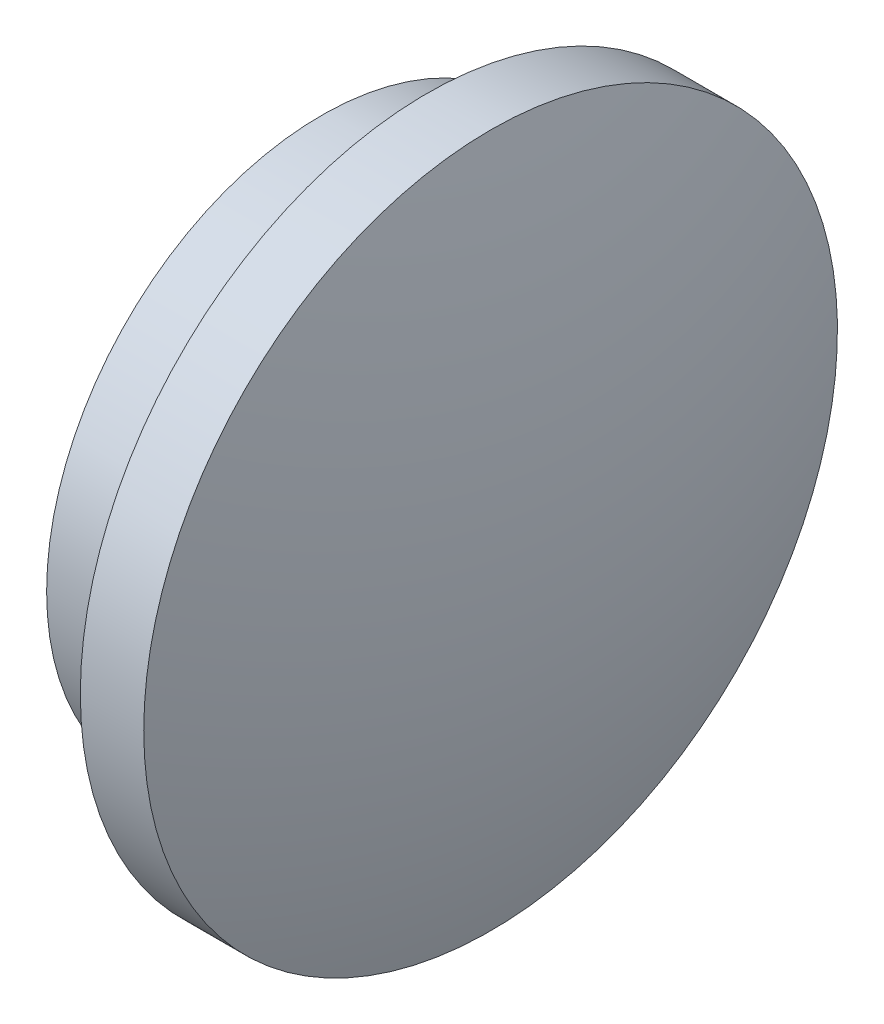
from build123d import *


with BuildPart() as part:
    # Sketch1 → Revolve1 (revolve)
    with BuildSketch(Plane.XY, mode=Mode.PRIVATE) as revolve1_sk:
        with BuildLine():
            Line((-12.577790871, 0), (-12.577790871, 26))
            Line((-12.577790871, 26), (-2.577790871, 26))
            Line((-2.577790871, 26), (-2.577790871, 32.812683447))
            Line((-2.577790871, 32.812683447), (3.422209129, 32.812683447))
            ThreePointArc((3.422209129, 32.812683447), (7.327981231, 16.612537084), (8.640768169, 0))
            Line((8.640768169, 0), (-12.577790871, 0))
        make_face()
    revolve(revolve1_sk.sketch.rotate(Axis((-44.921465969, 0, 0), (1, 0, 0)), 90), axis=Axis((-44.921465969, 0, 0), (1, 0, 0)))


solid = part.part
